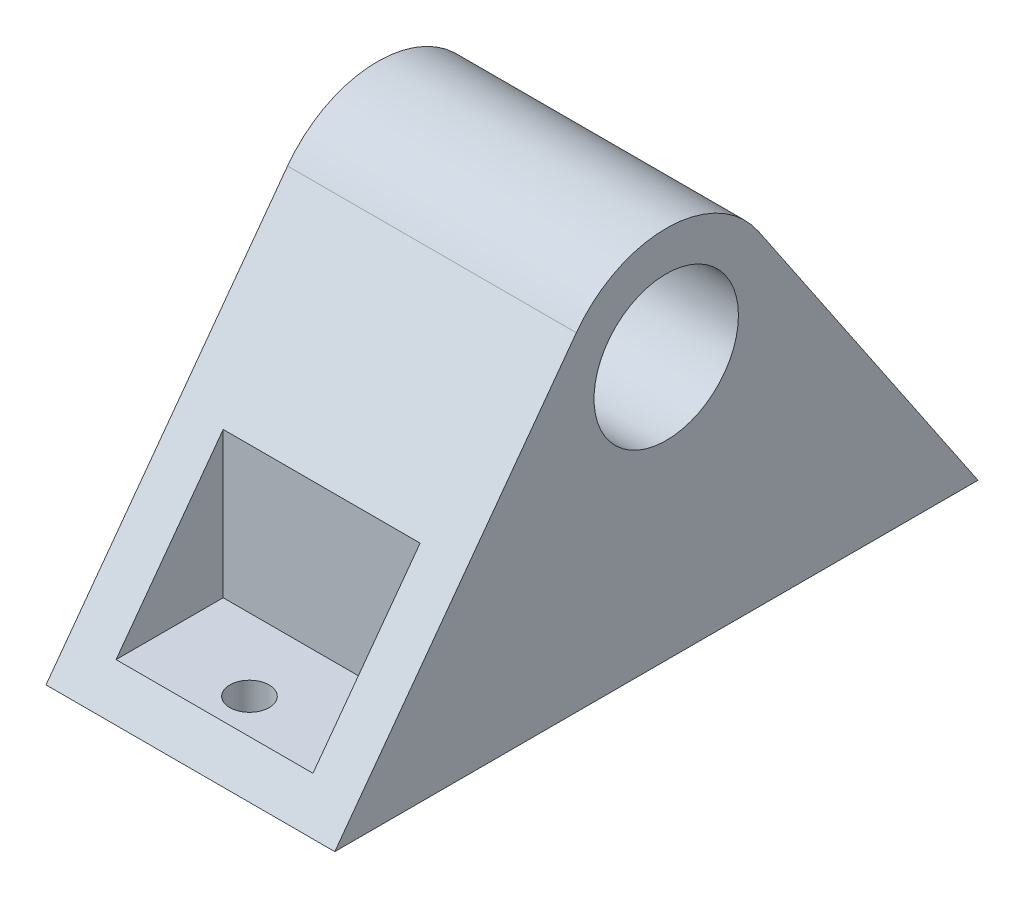
from build123d import *

# Parameters (mm, degrees)
ESBO_O1_R                = 5.5
RESSALTO_EXTRUS_O1_DEPTH = 22
ESBO_O5_W                = 15
ESBO_O5_H                = 10
CORTE_EXTRUS_O3_DEPTH    = 26
ESBO_O6_R                = 1.5
CORTE_EXTRUS_O4_DEPTH    = 44.548823176


with BuildPart() as part:
    # Esboço1 → Ressalto-extrusão1 (new body)
    with BuildSketch(Plane(origin=(0, 0, 0), x_dir=(0, 0, -1), z_dir=(1, 0, 0))):
        with BuildLine():
            Line((24.5, 0), (7.795898562, 24.754504543))
            ThreePointArc((7.795898562, 24.754504543), (0.921060547, 28.498278549), (-6.098863428, 25.034190078))
            Line((-6.098863428, 25.034190078), (-24.5, 0))
            Line((-24.5, 0), (24.5, 0))
        make_face()
        with Locations((0.75, 20)):
            Circle(ESBO_O1_R, mode=Mode.SUBTRACT)
    extrude(amount=RESSALTO_EXTRUS_O1_DEPTH)

    # Esboço5 → Corte-extrusão3 (cut)
    with BuildSketch(Plane(origin=(0, 28.5, 0), x_dir=(1, 0, 0), z_dir=(0, 1, 0))):
        with Locations((11, 19.5)):
            Rectangle(ESBO_O5_W, ESBO_O5_H)
        with Locations((11, -19.5)):
            Rectangle(ESBO_O5_W, ESBO_O5_H)
    extrude(amount=-CORTE_EXTRUS_O3_DEPTH, mode=Mode.SUBTRACT)

    # Esboço6 → Corte-extrusão4 (cut, through all)
    with BuildSketch(Plane(origin=(0, 28.5, 0), x_dir=(1, 0, 0), z_dir=(0, 1, 0))):
        with Locations(Location((11, 20, 0), (0, 0, 270))):
            Circle(ESBO_O6_R)
        with Locations(Location((11, -20, 0), (0, 0, 270))):
            Circle(ESBO_O6_R)
    extrude(amount=-CORTE_EXTRUS_O4_DEPTH, mode=Mode.SUBTRACT)


solid = part.part
